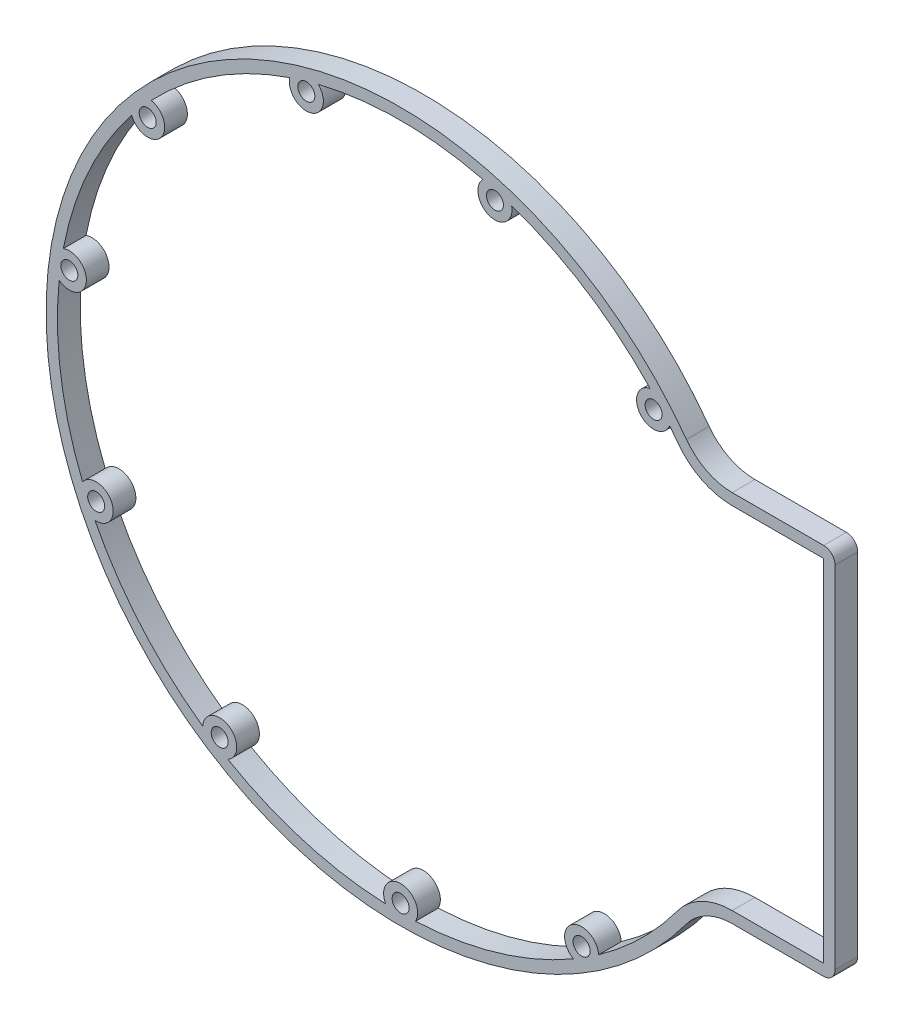
from build123d import *

# Parameters (mm, degrees)
SKETCH_1_R      = 1.5
EXTRUDE_1_DEPTH = 4


with BuildPart() as part:
    # 草图1 → 凸台-拉伸1 (new body)
    with BuildSketch(Plane.XY):
        with BuildLine():
            Line((58.445187997, 32.9), (74.5685, 32.9))
            ThreePointArc((74.5685, 32.9), (75.982713562, 32.314213562), (76.5685, 30.9))
            Line((76.5685, 30.9), (76.5685, -30.9))
            ThreePointArc((76.5685, -30.9), (75.982713562, -32.314213562), (74.5685, -32.9))
            Line((74.5685, -32.9), (58.445187997, -32.9))
            ThreePointArc((58.445187997, -32.9), (53.927025417, -33.978889817), (50.383782756, -36.982758621))
            ThreePointArc((50.383782756, -36.982758621), (-62.5, 0), (50.383782756, 36.982758621))
            ThreePointArc((50.383782756, 36.982758621), (53.927025417, 33.978889817), (58.445187997, 32.9))
        make_face()
        with Locations((0, -59)):
            Circle(SKETCH_1_R, mode=Mode.SUBTRACT)
        with Locations((-31.89780823, -49.633958437)):
            Circle(SKETCH_1_R, mode=Mode.SUBTRACT)
        with Locations((-53.668287726, -24.509485767)):
            Circle(SKETCH_1_R, mode=Mode.SUBTRACT)
        with Locations((-58.399465071, 8.396575458)):
            Circle(SKETCH_1_R, mode=Mode.SUBTRACT)
        with Locations((-44.589224887, 38.636783303)):
            Circle(SKETCH_1_R, mode=Mode.SUBTRACT)
        with Locations((-16.622220854, 56.610085443)):
            Circle(SKETCH_1_R, mode=Mode.SUBTRACT)
        with Locations((16.622220854, 56.610085443)):
            Circle(SKETCH_1_R, mode=Mode.SUBTRACT)
        with Locations((44.589224887, 38.636783303)):
            Circle(SKETCH_1_R, mode=Mode.SUBTRACT)
        with Locations((31.89780823, -49.633958437)):
            Circle(SKETCH_1_R, mode=Mode.SUBTRACT)
        with BuildLine():
            Line((58.445187997, -30.9), (74.5685, -30.9))
            Line((74.5685, -30.9), (74.5685, 30.9))
            Line((74.5685, 30.9), (58.445187997, 30.9))
            ThreePointArc((58.445187997, 30.9), (53.0233929, 32.19466778), (48.771501708, 35.799310345))
            ThreePointArc((48.771501708, 35.799310345), (48.095161057, 36.702935617), (47.402080553, 37.593786179))
            ThreePointArc((47.402080553, 37.593786179), (42.321976164, 36.672201101), (43.957155069, 41.569442121))
            ThreePointArc((43.957155069, 41.569442121), (32.708769456, 50.895838736), (19.552432438, 57.253405015))
            ThreePointArc((19.552432438, 57.253405015), (15.777023183, 53.731606522), (14.504974825, 58.735472292))
            ThreePointArc((14.504974825, 58.735472292), (0, 60.499999866), (-14.504974825, 58.735472292))
            ThreePointArc((-14.504974825, 58.735472292), (-15.777023183, 53.731606522), (-19.552432438, 57.253405015))
            ThreePointArc((-19.552432438, 57.253405015), (-32.708769456, 50.895838736), (-43.957155069, 41.569442121))
            ThreePointArc((-43.957155069, 41.569442121), (-42.321976164, 36.672201101), (-47.402080553, 37.593786179))
            ThreePointArc((-47.402080553, 37.593786179), (-55.032735719, 25.132608287), (-59.453249164, 11.205407793))
            ThreePointArc((-59.453249164, 11.205407793), (-55.430000745, 7.969630943), (-60.20190302, 5.998405856))
            ThreePointArc((-60.20190302, 5.998405856), (-59.884197234, -8.610047716), (-56.073356727, -22.716264336))
            ThreePointArc((-56.073356727, -22.716264336), (-50.93939174, -23.263240728), (-53.888046644, -27.501425943))
            ThreePointArc((-53.888046644, -27.501425943), (-45.722849122, -39.619074294), (-34.890569724, -49.425683044))
            ThreePointArc((-34.890569724, -49.425683044), (-30.275885778, -47.110197839), (-30.465116213, -52.269749321))
            ThreePointArc((-30.465116213, -52.269749321), (-17.04481965, -58.049324772), (-2.630273359, -60.44279661))
            ThreePointArc((-2.630273359, -60.44279661), (0, -56), (2.630273359, -60.44279661))
            ThreePointArc((2.630273359, -60.44279661), (17.044819652, -58.049324777), (30.465116213, -52.269749321))
            ThreePointArc((30.465116213, -52.269749321), (30.275885778, -47.110197839), (34.890569724, -49.425683044))
            ThreePointArc((34.890569724, -49.425683044), (42.382249319, -43.174007721), (48.771501708, -35.799310345))
            ThreePointArc((48.771501708, -35.799310345), (53.0233929, -32.19466778), (58.445187997, -30.9))
        make_face(mode=Mode.SUBTRACT)
    extrude(amount=EXTRUDE_1_DEPTH)


solid = part.part
